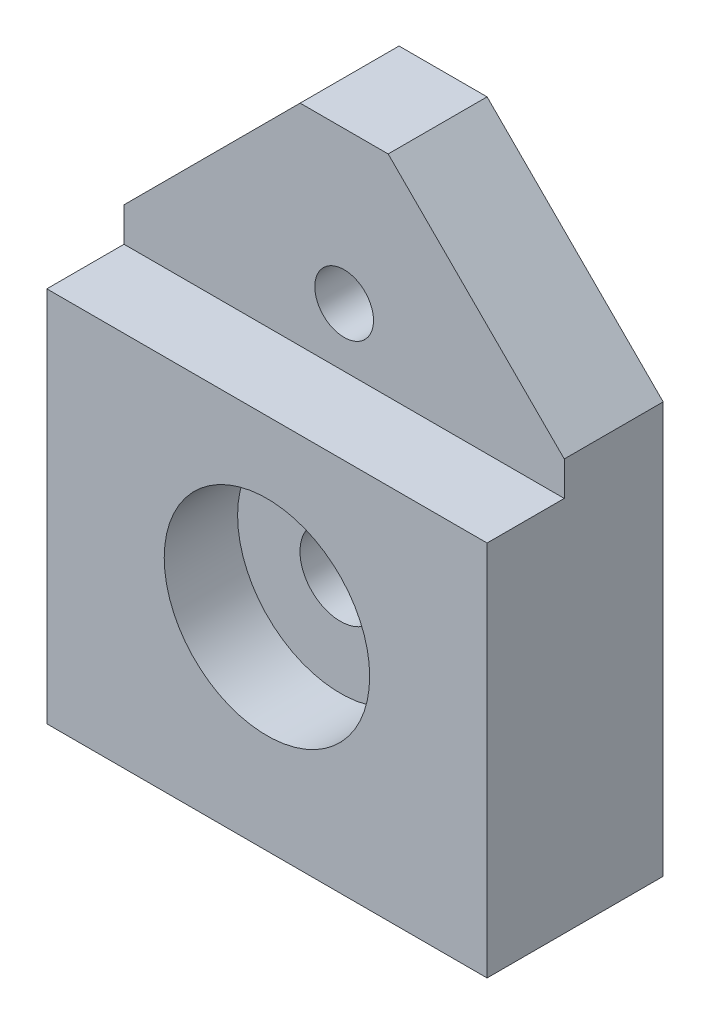
from build123d import *

# Parameters (mm, degrees)
RESSALTO_EXTRUS_O1_DEPTH       = 12
FURO_COM_FOLGA_DE_M51_D        = 5.5
ESBO_O9_R                      = 7
CORTE_EXTRUS_O3_DEPTH          = 5
CORTE_EXTRUS_O4_DEPTH          = 5.26
FURO_DE_DI_METRO_4_0_4_1_D     = 4
FURO_DE_DI_METRO_4_0_4_1_DEPTH = 6.74
FURO_DE_DI_METRO_4_0_4_1_TIP   = 1.201721238


with BuildPart() as part:
    # Esboço1 → Ressalto-extrusão1 (new body)
    with BuildSketch(Plane.XY):
        Polygon((69.044771166, -26.921923077), (81.044771166, -38.921923077), (81.044771166, -66.921923077), (51.044771166, -66.921923077), (51.044771166, -38.921923077), (63.044771166, -26.921923077), align=None)
    extrude(amount=RESSALTO_EXTRUS_O1_DEPTH)

    # Furo com folga de M51 (through all)
    with Locations(Plane.XY.offset(12)):
        with Locations((66.044771166, -53.121923077)):
            Hole(FURO_COM_FOLGA_DE_M51_D / 2)

    # Esboço9 → Corte-extrusão3 (cut)
    with BuildSketch(Plane.XY.offset(12)):
        with Locations((66.044771166, -53.121923077)):
            Circle(ESBO_O9_R)
    extrude(amount=-CORTE_EXTRUS_O3_DEPTH, mode=Mode.SUBTRACT)

    # Esboço10 → Corte-extrusão4 (cut)
    with BuildSketch(Plane.XY.offset(12)):
        Polygon((51.044771166, -41.251110711), (51.044771166, -38.921923077), (63.044771166, -26.921923077), (69.044771166, -26.921923077), (81.044771166, -38.921923077), (81.044771166, -41.251110711), align=None)
    extrude(amount=-CORTE_EXTRUS_O4_DEPTH, mode=Mode.SUBTRACT)

    # Furo de diâmetro Ø4.0 (4)1
    with Locations(Plane.XY.offset(6.74)):
        with Locations((66.044771166, -37.251110711)):
            Hole(FURO_DE_DI_METRO_4_0_4_1_D / 2, depth=FURO_DE_DI_METRO_4_0_4_1_DEPTH)
            with Locations((0, 0, -(FURO_DE_DI_METRO_4_0_4_1_DEPTH + FURO_DE_DI_METRO_4_0_4_1_TIP / 2))):  # 118° drill point
                Cone(0, FURO_DE_DI_METRO_4_0_4_1_D / 2, FURO_DE_DI_METRO_4_0_4_1_TIP, mode=Mode.SUBTRACT)


solid = part.part
